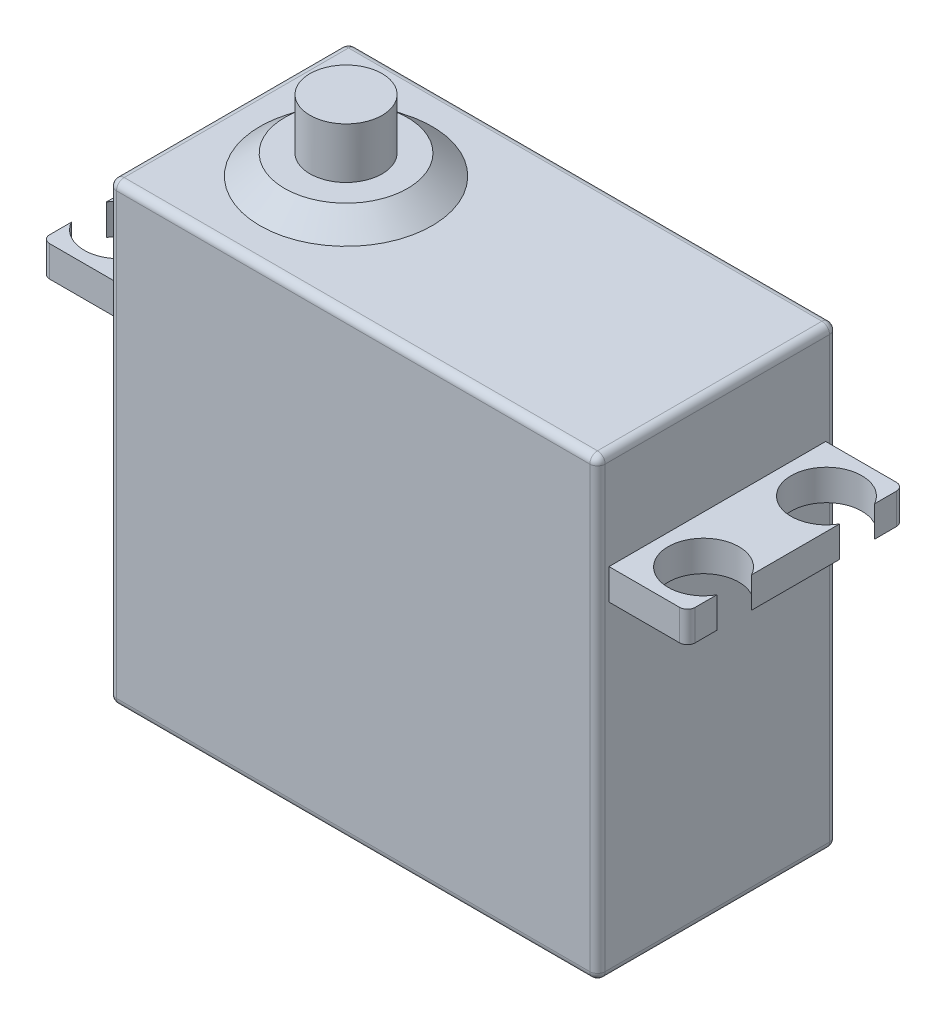
from build123d import *

# Parameters (mm, degrees)
BODY_W                      = 40.386
BODY_H                      = 19.812
SERVO_BODY_DEPTH            = 37.592
TAB_W                       = 17.907
TAB_H                       = 2.54
MOUNTING_TAB_DEPTH          = 6.477
FILLET1_R                   = 0.635
HOLES_R                     = 2.921
MOUNTING_HOLES_DEPTH        = 41.957844572
FILLET1_OF_MOUNTING_TAB_2_R = 0.635
SHAFT_R                     = 2.9845
SPLINE_SHAFT_DEPTH          = 4.191
FILLET2_R                   = 0.635


with BuildPart() as part:
    # body → servo_body (new body)
    with BuildSketch(Plane(origin=(0, 0, 0), x_dir=(1, 0, 0), z_dir=(0, 1, 0))):
        Rectangle(BODY_W, BODY_H)
    extrude(amount=SERVO_BODY_DEPTH)

    # tab → mounting_tab (add)
    with BuildSketch(Plane.ZY.offset(20.193)):
        with Locations((0, 28.194)):
            Rectangle(TAB_W, TAB_H)
    mounting_tab = extrude(amount=MOUNTING_TAB_DEPTH)

    # Fillet1
    fillet1_edges = [part.edges().sort_by_distance(p)[0] for p in [
        (-26.67, 28.194, -8.9535),
        (-26.67, 28.194, 8.9535),
    ]]
    fillet(fillet1_edges, radius=FILLET1_R)

    # holes → mounting_holes (cut, through all)
    with BuildSketch(Plane(origin=(0, 29.464, 0), x_dir=(-1, 0, 0), z_dir=(0, 1, 0))):
        with Locations((24.13, -5.08)):
            Circle(HOLES_R)
        with Locations((24.13, 5.08)):
            Circle(HOLES_R)
    mounting_holes = extrude(amount=-MOUNTING_HOLES_DEPTH, mode=Mode.SUBTRACT)

    # mounting_tab_2: mounting_tab, mounting_holes across plane
    add(mounting_tab.mirror(Plane(origin=(0, 0, 0), x_dir=(0, 0, 1), z_dir=(1, 0, 0))))
    add(mounting_holes.mirror(Plane(origin=(0, 0, 0), x_dir=(0, 0, 1), z_dir=(1, 0, 0))), mode=Mode.SUBTRACT)

    # Fillet1 of mounting_tab_2
    fillet1_of_mounting_tab_2_edges = [part.edges().sort_by_distance(p)[0] for p in [
        (26.67, 28.194, -8.9535),
        (26.67, 28.194, 8.9535),
    ]]
    fillet(fillet1_of_mounting_tab_2_edges, radius=FILLET1_OF_MOUNTING_TAB_2_R)

    # Sketch4 → Boss-Revolve1 (revolve)
    with BuildSketch(Plane.XY, mode=Mode.PRIVATE) as boss_revolve1_sk:
        Polygon((-10.4902, 37.592), (-3.3782, 37.592), (-5.4102, 39.243), (-10.4902, 39.243), align=None)
    revolve(boss_revolve1_sk.sketch.rotate(Axis((-10.4902, 39.598741813, 0), (0, -1, 0)), 90), axis=Axis((-10.4902, 39.598741813, 0), (0, -1, 0)))

    # shaft → spline_shaft (add)
    with BuildSketch(Plane(origin=(0, 39.243, 0), x_dir=(-1, 0, 0), z_dir=(0, 1, 0))):
        with Locations(Location((10.4902, 0, 0), (0, 0, 270))):
            Circle(SHAFT_R)
    extrude(amount=SPLINE_SHAFT_DEPTH)

    # Fillet2
    fillet2_edges = [part.edges().sort_by_distance(p)[0] for p in [
        (20.193, 37.592, 0),
        (0, 37.592, -9.906),
        (-20.193, 37.592, 0),
        (0, 0, -9.906),
        (20.193, 0, 0),
        (0, 0, 9.906),
        (-20.193, 0, 0),
        (0, 37.592, 9.906),
        (-20.193, 18.796, -9.906),
        (20.193, 18.796, -9.906),
        (20.193, 18.796, 9.906),
        (-20.193, 18.796, 9.906),
    ]]
    fillet(fillet2_edges, radius=FILLET2_R)


solid = part.part
